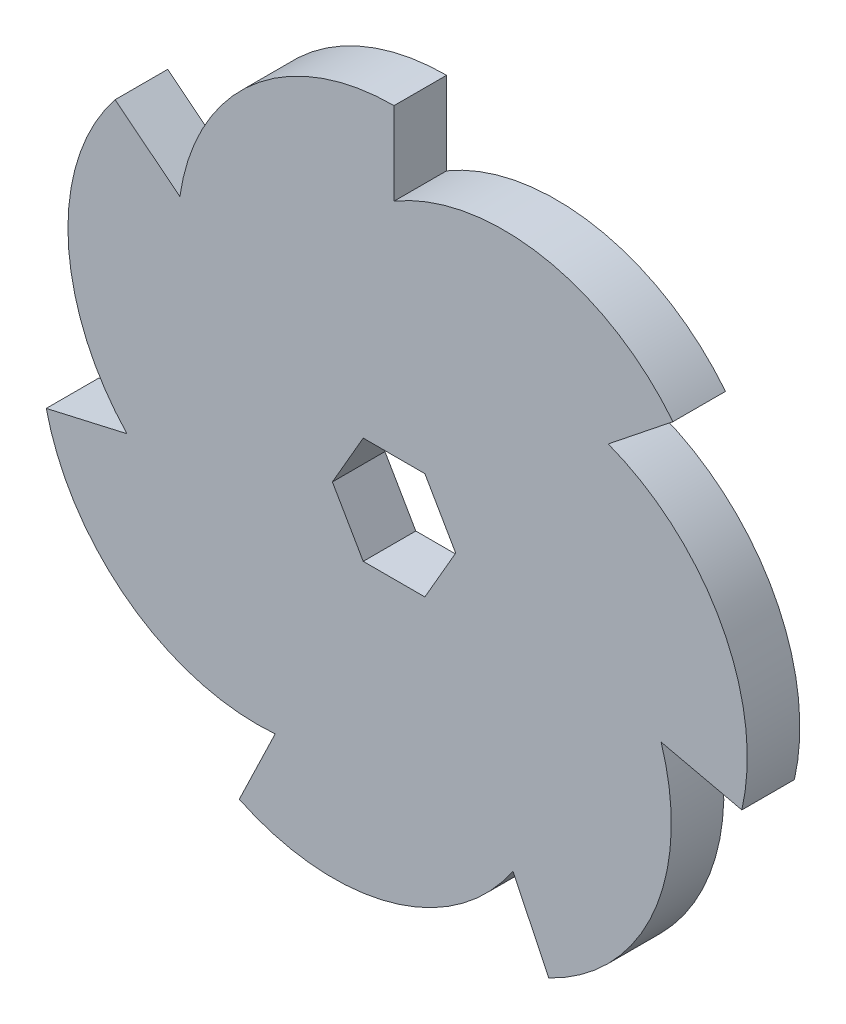
from build123d import *

# Parameters (mm, degrees)
BOSS_EXTRUDE1_DEPTH = 3.175
CIRPATTERN1_COUNT   = 7
CUT_EXTRUDE1_DEPTH  = 61.984142822


with BuildPart() as part:
    # Sketch1 → Boss-Extrude1 (new, symmetric)
    with BuildSketch(Plane.XY):
        with BuildLine():
            Line((0, 0), (0, 33.1))
            ThreePointArc((0, 33.1), (18.011361269, 36.278515567), (33.696936894, 26.87241046))
            Line((33.696936894, 26.87241046), (0, 0))
        make_face()
    boss_extrude1 = extrude(amount=BOSS_EXTRUDE1_DEPTH, both=True)

    # CirPattern1: Boss-Extrude1 ×7 about axis
    cirpattern1_axis = Axis((0, 0, 0), (0, 0, 1))
    for i in range(1, CIRPATTERN1_COUNT):
        add(boss_extrude1.rotate(cirpattern1_axis, i * 360 / CIRPATTERN1_COUNT))

    # Sketch2 → Cut-Extrude1 (cut, through all)
    with BuildSketch(Plane.XY.offset(3.175)):
        Polygon((7.447818473, 0), (3.723909236, 6.45), (-3.723909236, 6.45), (-7.447818473, 0), (-3.723909236, -6.45), (3.723909236, -6.45), align=None)
    extrude(amount=-CUT_EXTRUDE1_DEPTH, mode=Mode.SUBTRACT)


solid = part.part
